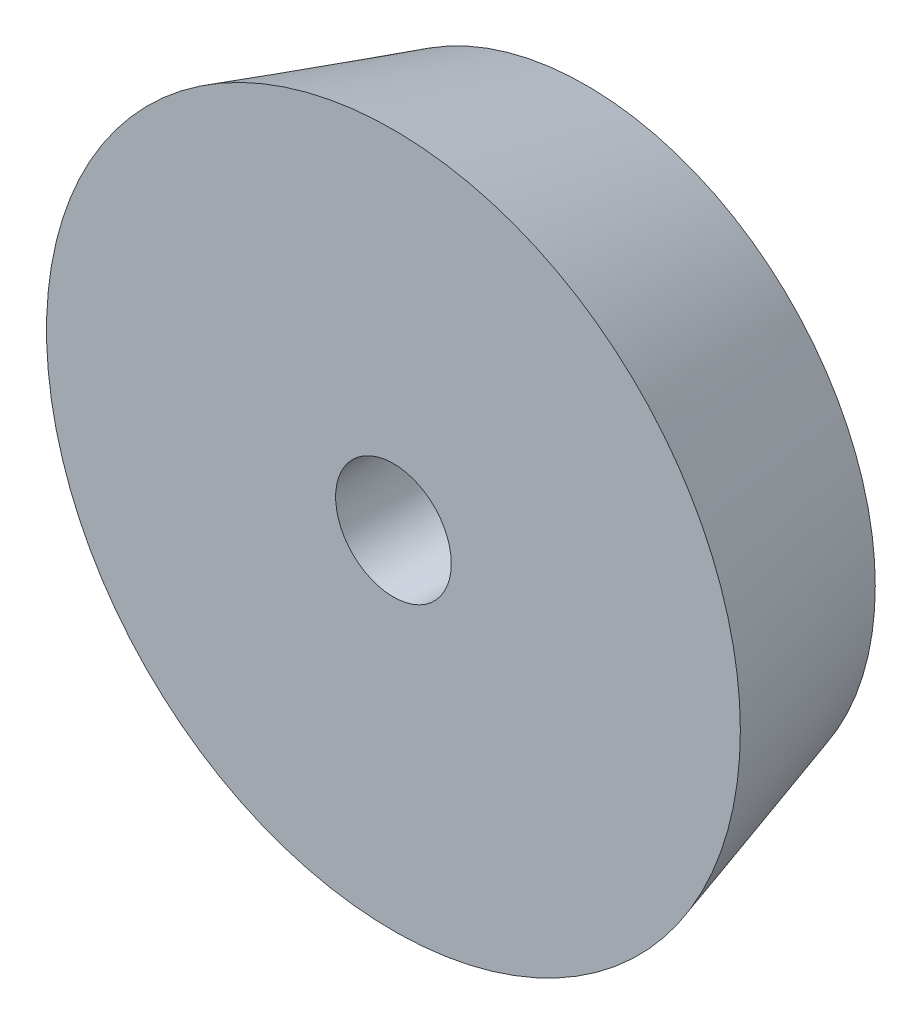
from build123d import *

# Parameters (mm, degrees)
SKETCH2_R          = 4.5
CUT_EXTRUDE1_DEPTH = 2


with BuildPart() as part:
    # Sketch1 → Revolve1 (revolve)
    with BuildSketch(Plane(origin=(0, 0, 0), x_dir=(1, 0, 0), z_dir=(0, 1, 0))):
        Polygon((1.5, 5), (1.5, 0), (9, 0), (7.5, 5), align=None)
    revolve(axis=Axis((0, 0, 0), (0, 0, -1)))

    # Sketch2 → Cut-Extrude1 (cut)
    with BuildSketch(Plane(origin=(0, 0, -5), x_dir=(-1, 0, 0), z_dir=(0, 0, -1))):
        Circle(SKETCH2_R)
    extrude(amount=-CUT_EXTRUDE1_DEPTH, mode=Mode.SUBTRACT)


solid = part.part
